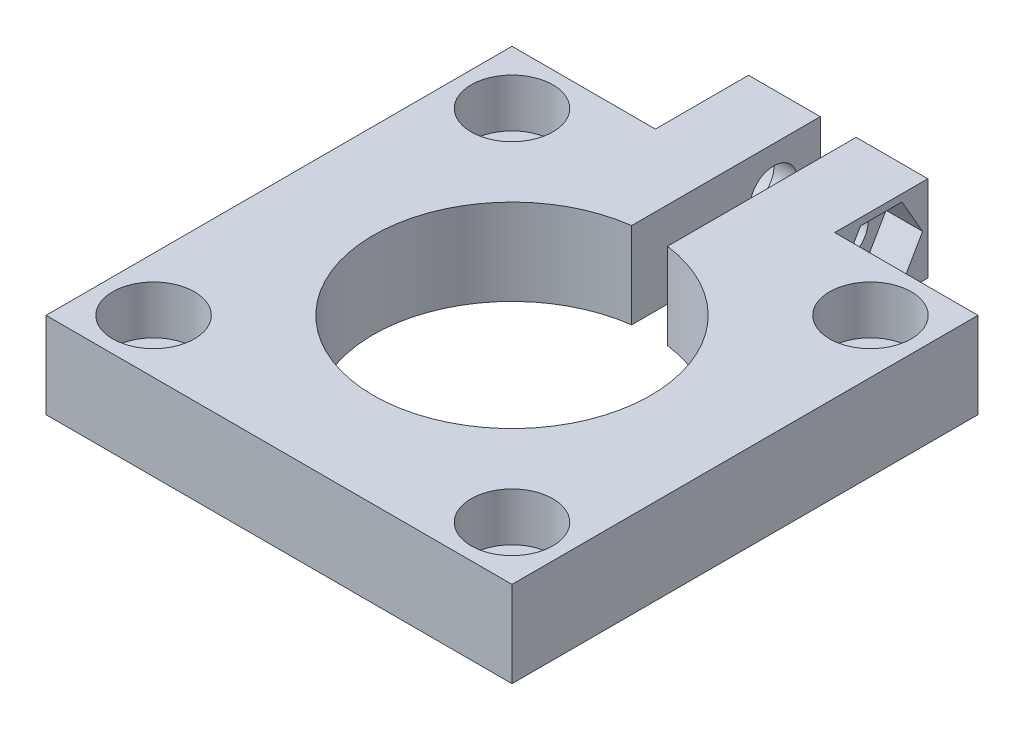
from build123d import *

# Parameters (mm, degrees)
SKETCH1_W                                           = 65
SKETCH1_H                                           = 65
BOSS_EXTRUDE1_DEPTH                                 = 12
SKETCH3_R                                           = 19.35
CUT_EXTRUDE1_DEPTH                                  = 12
SKETCH4_W                                           = 5
SKETCH4_H                                           = 40
CUT_EXTRUDE2_DEPTH                                  = 12
SKETCH5_W                                           = 10
SKETCH5_H                                           = 13
BOSS_EXTRUDE4_DEPTH                                 = 12
LPATTERN1_COUNT                                     = 2
LPATTERN1_PITCH                                     = 15
CBORE_FOR_M6_HEX_SOCKET_HEAD_CAP_SCREW1_D           = 6.6
CBORE_FOR_M6_HEX_SOCKET_HEAD_CAP_SCREW1_CBORE_D     = 10.5
CBORE_FOR_M6_HEX_SOCKET_HEAD_CAP_SCREW1_CBORE_DEPTH = 6.75
CUT_EXTRUDE3_DEPTH                                  = 5.1
CBORE_FOR_M6_HEX_SOCKET_HEAD_CAP_SCREW2_D           = 7.5
CBORE_FOR_M6_HEX_SOCKET_HEAD_CAP_SCREW2_CBORE_D     = 11.4
CBORE_FOR_M6_HEX_SOCKET_HEAD_CAP_SCREW2_CBORE_DEPTH = 6.75
CBORE_FOR_M6_HEX_SOCKET_HEAD_CAP_SCREW3_D           = 7.5
CBORE_FOR_M6_HEX_SOCKET_HEAD_CAP_SCREW3_CBORE_D     = 11.4
CBORE_FOR_M6_HEX_SOCKET_HEAD_CAP_SCREW3_CBORE_DEPTH = 6.75
CBORE_FOR_M6_HEX_SOCKET_HEAD_CAP_SCREW4_D           = 7.5
CBORE_FOR_M6_HEX_SOCKET_HEAD_CAP_SCREW4_CBORE_D     = 11.4
CBORE_FOR_M6_HEX_SOCKET_HEAD_CAP_SCREW4_CBORE_DEPTH = 6.75
CBORE_FOR_M6_HEX_SOCKET_HEAD_CAP_SCREW5_D           = 7.5
CBORE_FOR_M6_HEX_SOCKET_HEAD_CAP_SCREW5_CBORE_D     = 11.4
CBORE_FOR_M6_HEX_SOCKET_HEAD_CAP_SCREW5_CBORE_DEPTH = 6.75


with BuildPart() as part:
    # Sketch1 → Boss-Extrude1 (new body)
    with BuildSketch(Plane(origin=(0, 0, 0), x_dir=(1, 0, 0), z_dir=(0, 1, 0))):
        Rectangle(SKETCH1_W, SKETCH1_H)
    extrude(amount=BOSS_EXTRUDE1_DEPTH)

    # Sketch3 → Cut-Extrude1 (cut)
    with BuildSketch(Plane(origin=(0, 12, 0), x_dir=(-1, 0, 0), z_dir=(0, 1, 0))):
        with Locations(Location((0, 0, 0), (0, 0, 90))):
            Circle(SKETCH3_R)
    extrude(amount=-CUT_EXTRUDE1_DEPTH, mode=Mode.SUBTRACT)

    # Sketch4 → Cut-Extrude2 (cut)
    with BuildSketch(Plane(origin=(0, 12, 0), x_dir=(-1, 0, 0), z_dir=(0, 1, 0))):
        with Locations((0, -32.5)):
            Rectangle(SKETCH4_W, SKETCH4_H)
    extrude(amount=-CUT_EXTRUDE2_DEPTH, mode=Mode.SUBTRACT)

    # Sketch5 → Boss-Extrude4 (add)
    with BuildSketch(Plane(origin=(0, 12, 0), x_dir=(-1, 0, 0), z_dir=(0, 1, 0))):
        with Locations((7.5, -39)):
            Rectangle(SKETCH5_W, SKETCH5_H)
    boss_extrude4 = extrude(amount=-BOSS_EXTRUDE4_DEPTH)

    # LPattern1: Boss-Extrude4 ×2
    with Locations(*[(i * LPATTERN1_PITCH, 0, 0) for i in range(1, LPATTERN1_COUNT)]):
        add(boss_extrude4)

    # CBORE for M6 Hex Socket Head Cap Screw1 (through all)
    with Locations(Plane.ZY.offset(12.5)):
        with Locations((-39, 6)):
            CounterBoreHole(CBORE_FOR_M6_HEX_SOCKET_HEAD_CAP_SCREW1_D / 2, CBORE_FOR_M6_HEX_SOCKET_HEAD_CAP_SCREW1_CBORE_D / 2, CBORE_FOR_M6_HEX_SOCKET_HEAD_CAP_SCREW1_CBORE_DEPTH)

    # Sketch9 → Cut-Extrude3 (cut)
    with BuildSketch(Plane(origin=(12.5, 0, 0), x_dir=(0, 0, -1), z_dir=(1, 0, 0))):
        Polygon((44.773502692, 6), (41.886751346, 11), (36.113248654, 11), (33.226497308, 6), (36.113248654, 1), (41.886751346, 1), align=None)
    extrude(amount=-CUT_EXTRUDE3_DEPTH, mode=Mode.SUBTRACT)

    # CBORE for M6 Hex Socket Head Cap Screw2 (through all)
    with Locations(Plane(origin=(0, 12, 0), x_dir=(-1, 0, 0), z_dir=(0, 1, 0))):
        with Locations((25, -25)):
            CounterBoreHole(CBORE_FOR_M6_HEX_SOCKET_HEAD_CAP_SCREW2_D / 2, CBORE_FOR_M6_HEX_SOCKET_HEAD_CAP_SCREW2_CBORE_D / 2, CBORE_FOR_M6_HEX_SOCKET_HEAD_CAP_SCREW2_CBORE_DEPTH)

    # CBORE for M6 Hex Socket Head Cap Screw3 (through all)
    with Locations(Plane(origin=(0, 12, 0), x_dir=(-1, 0, 0), z_dir=(0, 1, 0))):
        with Locations((-25, -25)):
            CounterBoreHole(CBORE_FOR_M6_HEX_SOCKET_HEAD_CAP_SCREW3_D / 2, CBORE_FOR_M6_HEX_SOCKET_HEAD_CAP_SCREW3_CBORE_D / 2, CBORE_FOR_M6_HEX_SOCKET_HEAD_CAP_SCREW3_CBORE_DEPTH)

    # CBORE for M6 Hex Socket Head Cap Screw4 (through all)
    with Locations(Plane(origin=(0, 12, 0), x_dir=(-1, 0, 0), z_dir=(0, 1, 0))):
        with Locations((-25, 25)):
            CounterBoreHole(CBORE_FOR_M6_HEX_SOCKET_HEAD_CAP_SCREW4_D / 2, CBORE_FOR_M6_HEX_SOCKET_HEAD_CAP_SCREW4_CBORE_D / 2, CBORE_FOR_M6_HEX_SOCKET_HEAD_CAP_SCREW4_CBORE_DEPTH)

    # CBORE for M6 Hex Socket Head Cap Screw5 (through all)
    with Locations(Plane(origin=(0, 12, 0), x_dir=(-1, 0, 0), z_dir=(0, 1, 0))):
        with Locations((25, 25)):
            CounterBoreHole(CBORE_FOR_M6_HEX_SOCKET_HEAD_CAP_SCREW5_D / 2, CBORE_FOR_M6_HEX_SOCKET_HEAD_CAP_SCREW5_CBORE_D / 2, CBORE_FOR_M6_HEX_SOCKET_HEAD_CAP_SCREW5_CBORE_DEPTH)


solid = part.part
